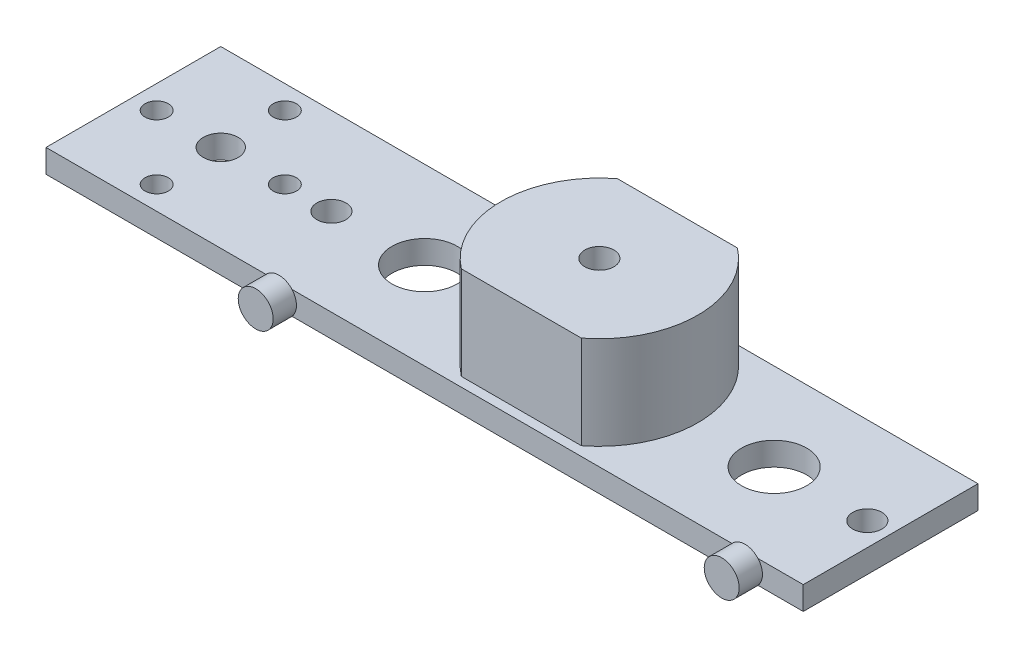
from build123d import *

# Parameters (mm, degrees)
SKETCH_1_W               = 65
SKETCH_1_H               = 15
EXTRUDE_1_DEPTH          = 2
SKETCH_2_R               = 1.25
SKETCH_2_R_2             = 2.8
SKETCH_2_R_3             = 1.5
SKETCH_2_R_4             = 1
CUT_EXTRUDE_1_DEPTH      = 2
SKETCH_4_R               = 1.5
EXTRUDE_2_DEPTH          = 2
EXTRUDE_3_DEPTH          = 8
SKETCH_5_8_R             = 1.25
EXTRUDE_4_DEPTH          = 8
CUT_EXTRUDE_2_DEPTH      = 5.5
CUT_EXTRUDE_2_DEPTH_BACK = 42.883767739
SKETCH_5_11_R            = 1.25


with BuildPart() as part:
    # 草图1 → 凸台-拉伸1 (new body)
    with BuildSketch(Plane(origin=(0, 0, 0), x_dir=(1, 0, 0), z_dir=(0, 1, 0))):
        with Locations((-7.5, 0)):
            Rectangle(SKETCH_1_W, SKETCH_1_H)
    extrude(amount=EXTRUDE_1_DEPTH)

    # 草图2 → 切除-拉伸1 (cut)
    with BuildSketch(Plane(origin=(0, 0, 0), x_dir=(1, 0, 0), z_dir=(0, 1, 0))):
        with Locations(Location((0, 0, 0), (0, 0, 270))):
            Circle(SKETCH_2_R)
        with Locations(Location((15, 0, 0), (0, 0, 270))):
            Circle(SKETCH_2_R_2)
        with Locations(Location((-15, 0, 0), (0, 0, 90))):
            Circle(SKETCH_2_R_2)
        with Locations(Location((23, 0, 0), (0, 0, 270))):
            Circle(SKETCH_2_R)
        with Locations(Location((-23, 0, 0), (0, 0, 90))):
            Circle(SKETCH_2_R)
        with Locations(Location((-32.5, 0, 0), (0, 0, 270))):
            Circle(SKETCH_2_R_3)
        with Locations(Location((-27, 0, 0), (0, 0, 270))):
            Circle(SKETCH_2_R_4)
        with Locations(Location((-32.5, -5.5, 0), (0, 0, 270))):
            Circle(SKETCH_2_R_4)
        with Locations(Location((-38, 0, 0), (0, 0, 270))):
            Circle(SKETCH_2_R_4)
        with Locations(Location((-32.5, 5.5, 0), (0, 0, 270))):
            Circle(SKETCH_2_R_4)
    extrude(amount=CUT_EXTRUDE_1_DEPTH, mode=Mode.SUBTRACT)

    # 草图4 → 凸台-拉伸2 (add)
    with BuildSketch(Plane.XY.offset(7.5)):
        with Locations(Location((20, 1, 0), (0, 0, 221.810314896))):
            Circle(SKETCH_4_R)
        with Locations(Location((-20, 1, 0), (0, 0, 221.810314896))):
            Circle(SKETCH_4_R)
    extrude(amount=EXTRUDE_2_DEPTH)

    # 草图5 → 凸台-拉伸3 (add)
    with BuildSketch(Plane(origin=(0, 2, 0), x_dir=(1, 0, 0), z_dir=(0, 1, 0))):
        with BuildLine():
            Line((5.149029035, -6.7), (-5.149029035, -6.7))
            ThreePointArc((-5.149029035, -6.7), (-8.45, 0), (-5.149029035, 6.7))
            Line((-5.149029035, 6.7), (5.149029035, 6.7))
            ThreePointArc((5.149029035, 6.7), (8.45, 0), (5.149029035, -6.7))
        make_face()
        with BuildLine():
            Line((4.905354218, -6), (-4.905354218, -6))
            ThreePointArc((-4.905354218, -6), (-7.75, 0), (-4.905354218, 6))
            Line((-4.905354218, 6), (4.905354218, 6))
            ThreePointArc((4.905354218, 6), (7.75, 0), (4.905354218, -6))
        make_face(mode=Mode.SUBTRACT)
    extrude(amount=EXTRUDE_3_DEPTH)

    # 草图5<8> → 凸台-拉伸4 (add)
    with BuildSketch(Plane(origin=(0, 2, 0), x_dir=(1, 0, 0), z_dir=(0, 1, 0))):
        with BuildLine():
            Line((4.905354218, -6), (-4.905354218, -6))
            ThreePointArc((-4.905354218, -6), (-7.75, 0), (-4.905354218, 6))
            Line((-4.905354218, 6), (4.905354218, 6))
            ThreePointArc((4.905354218, 6), (7.75, 0), (4.905354218, -6))
        make_face()
        with Locations(Location((0, 0, 0), (0, 0, 270))):
            Circle(SKETCH_5_8_R, mode=Mode.SUBTRACT)
    extrude(amount=EXTRUDE_4_DEPTH)

    # 草图5<11> → 切除-拉伸2 (cut, two sides: drawn at the far end of the back side and taken through both)
    with BuildSketch(Plane(origin=(0, 2, 0), x_dir=(1, 0, 0), z_dir=(0, 1, 0)).offset(-CUT_EXTRUDE_2_DEPTH_BACK)):
        with BuildLine():
            Line((4.905354218, -6), (-4.905354218, -6))
            ThreePointArc((-4.905354218, -6), (-7.75, 0), (-4.905354218, 6))
            Line((-4.905354218, 6), (4.905354218, 6))
            ThreePointArc((4.905354218, 6), (7.75, 0), (4.905354218, -6))
        make_face()
        with Locations(Location((0, 0, 0), (0, 0, 270))):
            Circle(SKETCH_5_11_R, mode=Mode.SUBTRACT)
    extrude(amount=CUT_EXTRUDE_2_DEPTH + CUT_EXTRUDE_2_DEPTH_BACK, mode=Mode.SUBTRACT)


solid = part.part
